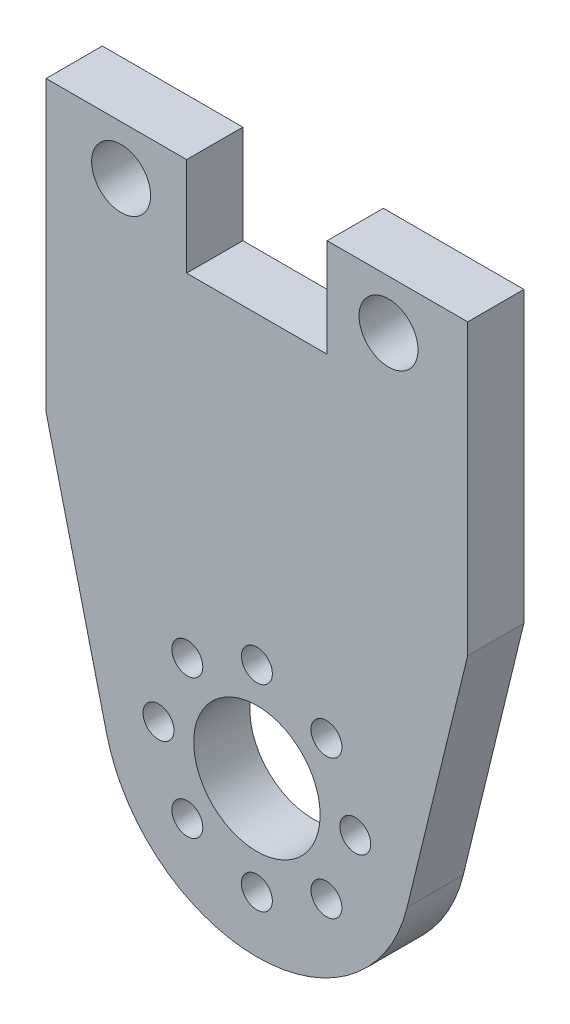
from build123d import *

# Parameters (mm, degrees)
ESQUISSE1_R        = 4.5
ESQUISSE1_R_2      = 1.1
BOSS_EXTRU_1_DEPTH = 4
SKETCH1_R          = 2.1
CUT_EXTRUDE1_DEPTH = 43.574273021


with BuildPart() as part:
    # Esquisse1 → Boss.-Extru.1 (new body)
    with BuildSketch(Plane.XY):
        with BuildLine():
            Line((-15, 3), (-15, 7))
            Line((-15, 7), (-5, 7))
            Line((-5, 7), (-5, 0))
            Line((-5, 0), (5, 0))
            Line((5, 0), (5, 7))
            Line((5, 7), (15, 7))
            Line((15, 7), (15, 3))
            Line((15, 3), (15, -13.574063778))
            Line((15, -13.574063778), (10.686419419, -31.250781398))
            ThreePointArc((10.686419419, -31.250781398), (0, -39.643016072), (-10.686419419, -31.250781398))
            Line((-10.686419419, -31.250781398), (-15, -13.574063778))
            Line((-15, -13.574063778), (-15, 3))
        make_face()
        with Locations((0, -28.643016072)):
            Circle(ESQUISSE1_R, mode=Mode.SUBTRACT)
        with Locations((0, -21.643016072)):
            Circle(ESQUISSE1_R_2, mode=Mode.SUBTRACT)
        with Locations((4.949747468, -23.693268604)):
            Circle(ESQUISSE1_R_2, mode=Mode.SUBTRACT)
        with Locations((7, -28.643016072)):
            Circle(ESQUISSE1_R_2, mode=Mode.SUBTRACT)
        with Locations((4.949747468, -33.59276354)):
            Circle(ESQUISSE1_R_2, mode=Mode.SUBTRACT)
        with Locations((0, -35.643016072)):
            Circle(ESQUISSE1_R_2, mode=Mode.SUBTRACT)
        with Locations((-4.949747468, -33.59276354)):
            Circle(ESQUISSE1_R_2, mode=Mode.SUBTRACT)
        with Locations((-7, -28.643016072)):
            Circle(ESQUISSE1_R_2, mode=Mode.SUBTRACT)
        with Locations((-4.949747468, -23.693268604)):
            Circle(ESQUISSE1_R_2, mode=Mode.SUBTRACT)
    extrude(amount=BOSS_EXTRU_1_DEPTH)

    # Sketch1 → Cut-Extrude1 (cut, through all)
    with BuildSketch(Plane(origin=(0, 0, 0), x_dir=(-1, 0, 0), z_dir=(0, 0, -1))):
        with Locations((-9.368015407, 3.5)):
            Circle(SKETCH1_R)
        with Locations((9.663609861, 3.5)):
            Circle(SKETCH1_R)
    extrude(amount=-CUT_EXTRUDE1_DEPTH, mode=Mode.SUBTRACT)


solid = part.part
